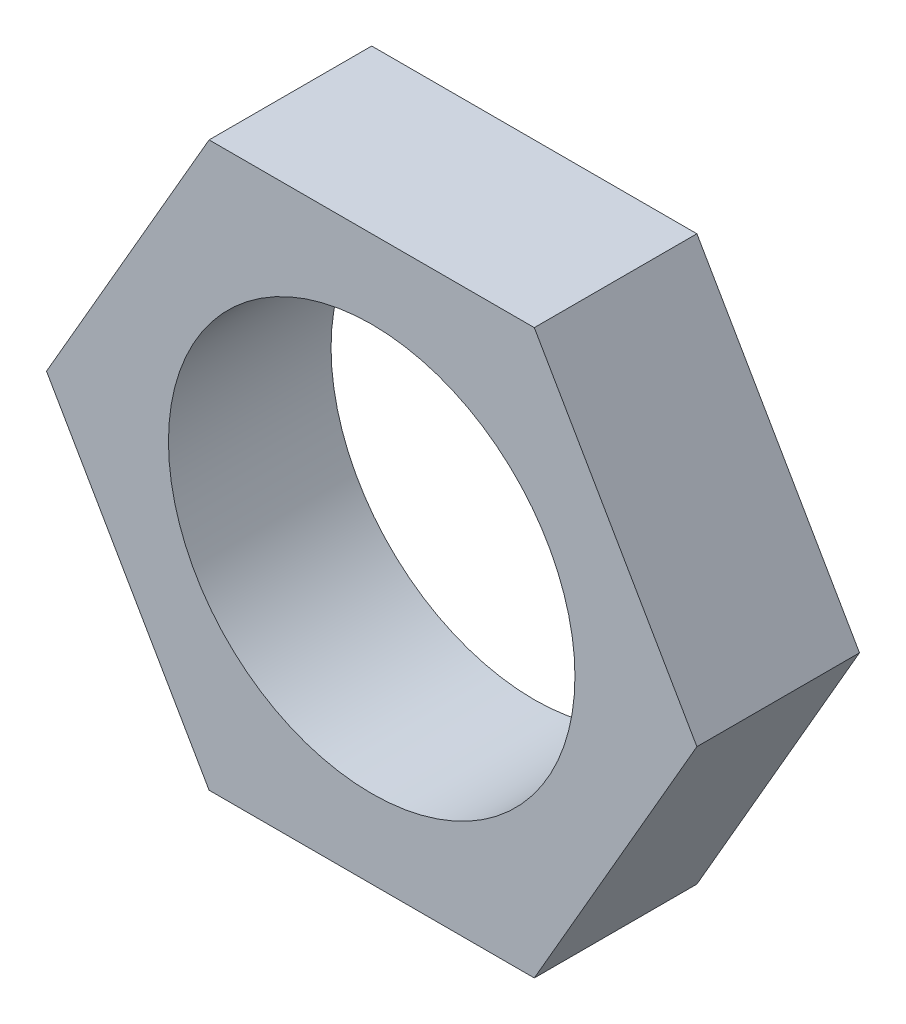
from build123d import *

# Parameters (mm, degrees)
SKETCH1_R           = 3.175
BOSS_EXTRUDE1_DEPTH = 2.54


with BuildPart() as part:
    # Sketch1 → Boss-Extrude1 (new body)
    with BuildSketch(Plane.XY):
        Polygon((2.54, -4.399409051), (5.08, 0), (2.54, 4.399409051), (-2.54, 4.399409051), (-5.08, 0), (-2.54, -4.399409051), align=None)
        Circle(SKETCH1_R, mode=Mode.SUBTRACT)
    extrude(amount=BOSS_EXTRUDE1_DEPTH)


solid = part.part
